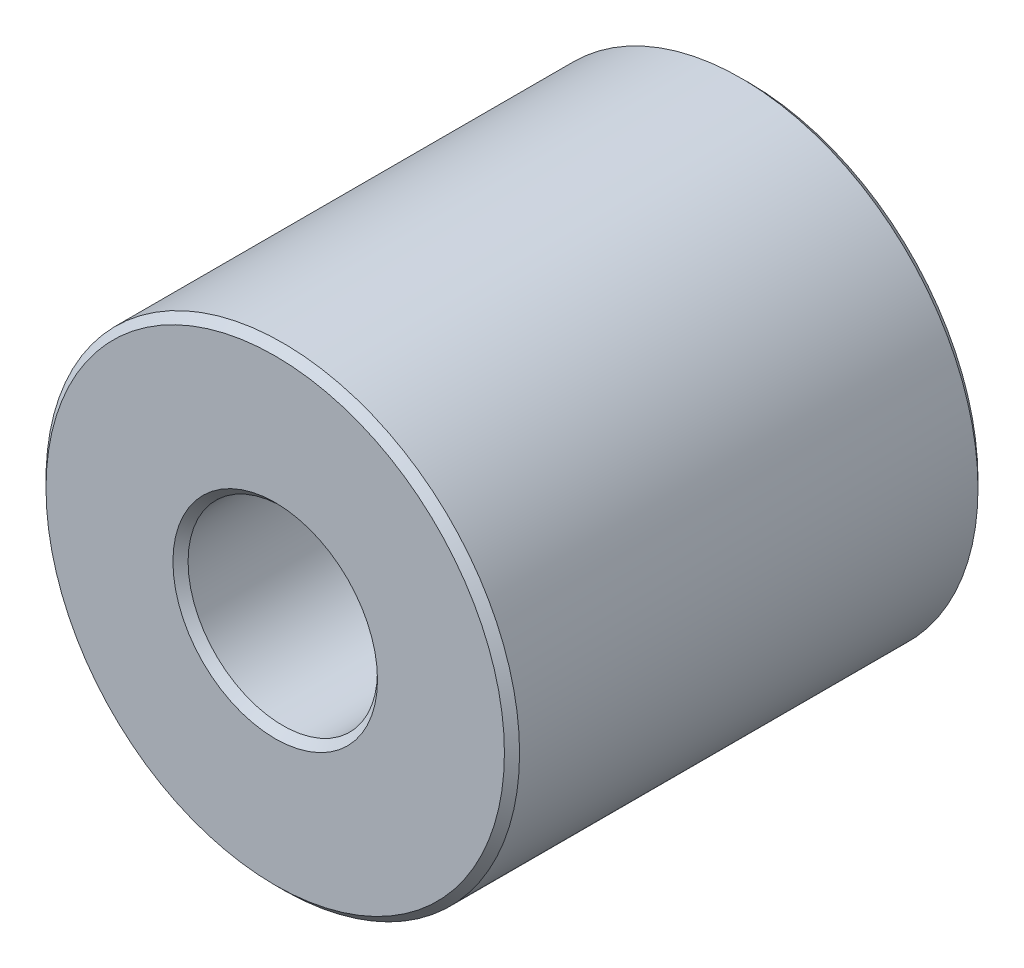
from build123d import *

# Parameters (mm, degrees)
SKETCH1_R           = 7.9375
SKETCH1_R_2         = 3.175
BOSS_EXTRUDE1_DEPTH = 15.875
CHAMFER1_SIZE       = 0.254


with BuildPart() as part:
    # Sketch1 → Boss-Extrude1 (new body)
    with BuildSketch(Plane.XY):
        Circle(SKETCH1_R)
        Circle(SKETCH1_R_2, mode=Mode.SUBTRACT)
    extrude(amount=BOSS_EXTRUDE1_DEPTH)

    # Chamfer1
    chamfer1_edges = [part.edges().sort_by_distance(p)[0] for p in [
        (-7.9375, 0, 0),
        (-7.9375, 0, 15.875),
        (-3.175, 0, 0),
        (-3.175, 0, 15.875),
    ]]
    chamfer(chamfer1_edges, length=CHAMFER1_SIZE)


solid = part.part
